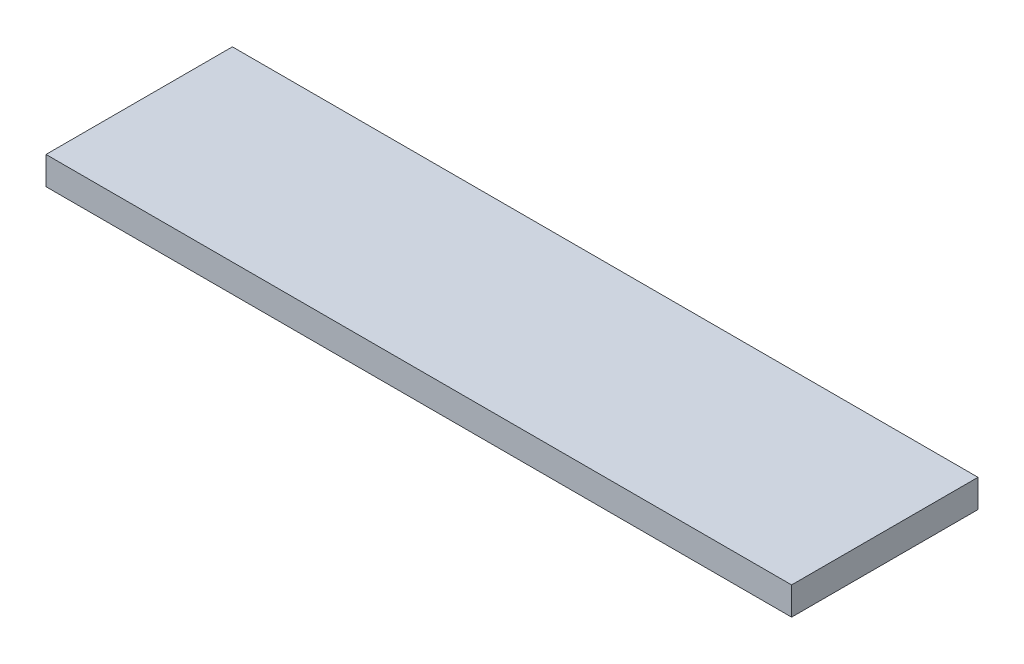
from build123d import *

# Parameters (mm, degrees)
SKETCH1_W           = 80
SKETCH1_H           = 20
BOSS_EXTRUDE1_DEPTH = 3


with BuildPart() as part:
    # Sketch1 → Boss-Extrude1 (new body)
    with BuildSketch(Plane(origin=(0, 0, 0), x_dir=(1, 0, 0), z_dir=(0, 1, 0))):
        with Locations((15.155279503, 0.745341615)):
            Rectangle(SKETCH1_W, SKETCH1_H)
    extrude(amount=BOSS_EXTRUDE1_DEPTH)


solid = part.part
